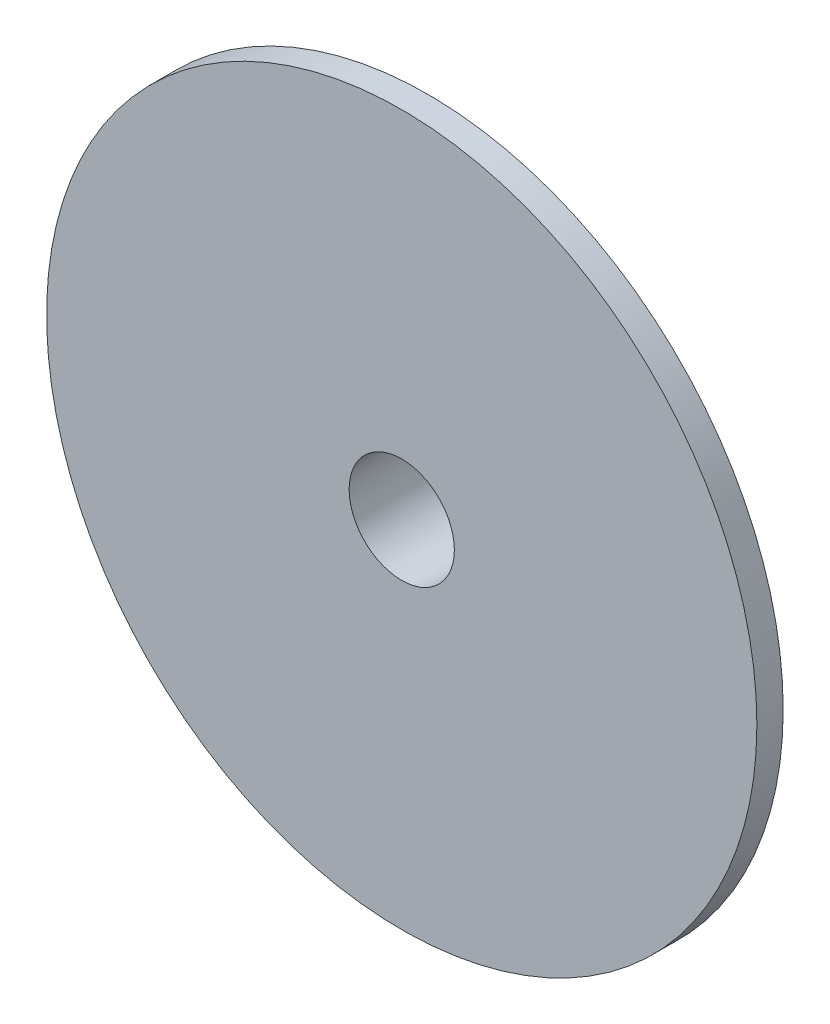
from build123d import *

# Parameters (mm, degrees)
SKETCH_1_R          = 27
EXTRUDE_1_DEPTH     = 2
SKETCH_2_R          = 5.5
EXTRUDE_2_DEPTH     = 15
SKETCH_3_R          = 4
CUT_EXTRUDE_1_DEPTH = 150


with BuildPart() as part:
    # 草图1 → 凸台-拉伸1 (new body)
    with BuildSketch(Plane.XY):
        Circle(SKETCH_1_R)
    extrude(amount=EXTRUDE_1_DEPTH)

    # 草图2 → 凸台-拉伸2 (add)
    with BuildSketch(Plane.XY):
        Circle(SKETCH_2_R)
    extrude(amount=-EXTRUDE_2_DEPTH)

    # 草图3 → 切除-拉伸1 (cut)
    with BuildSketch(Plane(origin=(0, 0, -15), x_dir=(-1, 0, 0), z_dir=(0, 0, -1))):
        Circle(SKETCH_3_R)
    extrude(amount=-CUT_EXTRUDE_1_DEPTH, mode=Mode.SUBTRACT)


solid = part.part
